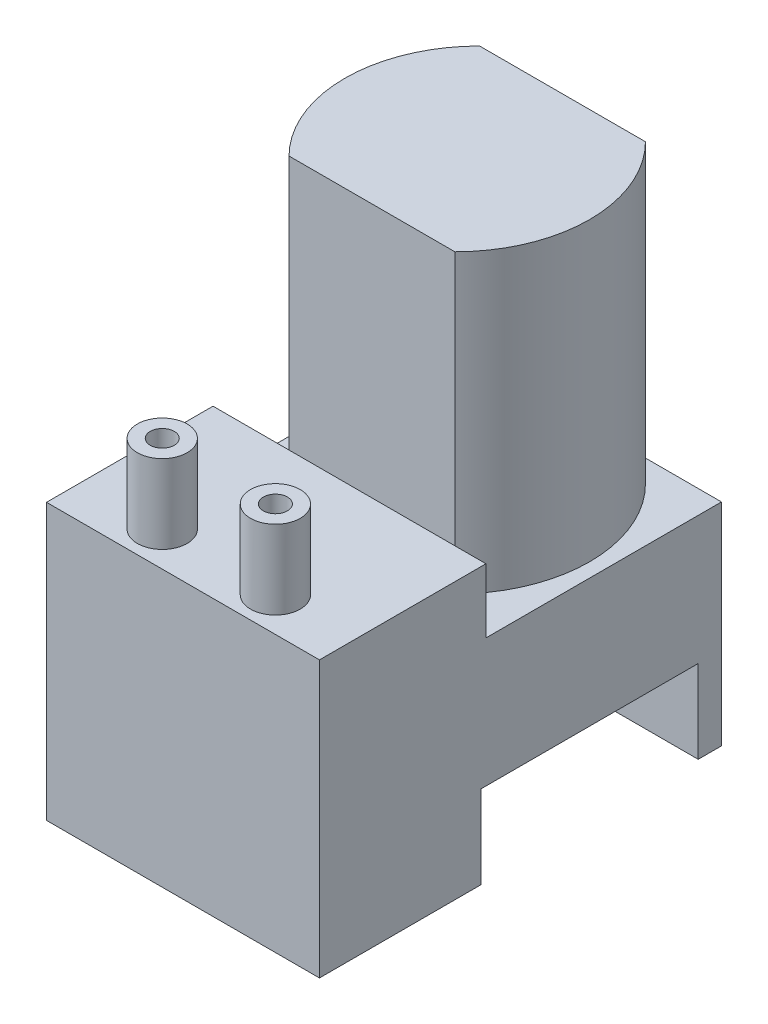
from build123d import *

# Parameters (mm, degrees)
SKETCH2_W           = 17
SKETCH2_H           = 17.16
BOSS_EXTRUDE1_DEPTH = 25.04
SKETCH3_R           = 1.55
BOSS_EXTRUDE2_DEPTH = 4.9
SKETCH4_R           = 0.75
CUT_EXTRUDE1_DEPTH  = 4.9
SKETCH6_R           = 0.75
CUT_EXTRUDE3_DEPTH  = 4.9
SKETCH7_W           = 17
SKETCH7_H           = 13.52
CUT_EXTRUDE4_DEPTH  = 5.17
CUT_EXTRUDE5_REACH  = 35.132
SKETCH8_W           = 14.67
SKETCH8_H           = 4
SKETCH9_W           = 13.54
SKETCH9_H           = 5.64
CUT_EXTRUDE7_DEPTH  = 15.01
BOSS_EXTRUDE3_DEPTH = 18.46


with BuildPart() as part:
    # Sketch2 → Boss-Extrude1 (new body)
    with BuildSketch(Plane.XY):
        Rectangle(SKETCH2_W, SKETCH2_H)
    extrude(amount=BOSS_EXTRUDE1_DEPTH)

    # Sketch3 → Boss-Extrude2 (add)
    with BuildSketch(Plane(origin=(0, 8.58, 0), x_dir=(1, 0, 0), z_dir=(0, 1, 0))):
        with Locations(Location((3.616285273, -22.901678995, 0), (0, 0, 90))):
            Circle(SKETCH3_R)
        with Locations(Location((-3.446563333, -22.884960512, 0), (0, 0, 90))):
            Circle(SKETCH3_R)
    extrude(amount=BOSS_EXTRUDE2_DEPTH)

    # Sketch4 → Cut-Extrude1 (cut)
    with BuildSketch(Plane(origin=(0, 13.48, 0), x_dir=(1, 0, 0), z_dir=(0, 1, 0))):
        with Locations(Location((3.616285273, -22.901678995, 0), (0, 0, 270))):
            Circle(SKETCH4_R)
    extrude(amount=-CUT_EXTRUDE1_DEPTH, mode=Mode.SUBTRACT)

    # Sketch6 → Cut-Extrude3 (cut)
    with BuildSketch(Plane(origin=(0, 13.48, 0), x_dir=(1, 0, 0), z_dir=(0, 1, 0))):
        with Locations(Location((-3.446563333, -22.884960512, 0), (0, 0, 270))):
            Circle(SKETCH6_R)
    extrude(amount=-CUT_EXTRUDE3_DEPTH, mode=Mode.SUBTRACT)

    # Sketch7 → Cut-Extrude4 (cut)
    with BuildSketch(Plane.XZ.offset(8.58)):
        with Locations((0, 8.21)):
            Rectangle(SKETCH7_W, SKETCH7_H)
    extrude(amount=-CUT_EXTRUDE4_DEPTH, mode=Mode.SUBTRACT)

    # Sketch8 → Cut-Extrude5 (cut, up to next)
    with BuildSketch(Plane.ZY.offset(8.5), mode=Mode.PRIVATE) as cut_extrude5_sk1:
        with Locations((7.335, 6.58)):
            Rectangle(SKETCH8_W, SKETCH8_H)
    cut_extrude5_tool1 = extrude(cut_extrude5_sk1.sketch, amount=-CUT_EXTRUDE5_REACH, mode=Mode.PRIVATE) & part.part
    add(cut_extrude5_tool1.solids().sort_by_distance((-8.5, 6.58, 7.335))[0], mode=Mode.SUBTRACT)

    # Sketch9 → Cut-Extrude7 (cut)
    with BuildSketch(Plane.ZY.offset(8.5)):
        with Locations((8.22, -0.59)):
            Rectangle(SKETCH9_W, SKETCH9_H)
    extrude(amount=-CUT_EXTRUDE7_DEPTH, mode=Mode.SUBTRACT)

    # Sketch10 → Boss-Extrude3 (add)
    with BuildSketch(Plane(origin=(0, 4.58, 0), x_dir=(1, 0, 0), z_dir=(0, 1, 0))):
        with BuildLine():
            Line((5.165, -13.27), (-5.165, -13.27))
            ThreePointArc((-5.165, -13.27), (-7.623357493, -7.335), (-5.165, -1.4))
            Line((-5.165, -1.4), (5.165, -1.4))
            ThreePointArc((5.165, -1.4), (7.623357493, -7.335), (5.165, -13.27))
        make_face()
    extrude(amount=BOSS_EXTRUDE3_DEPTH)


solid = part.part
